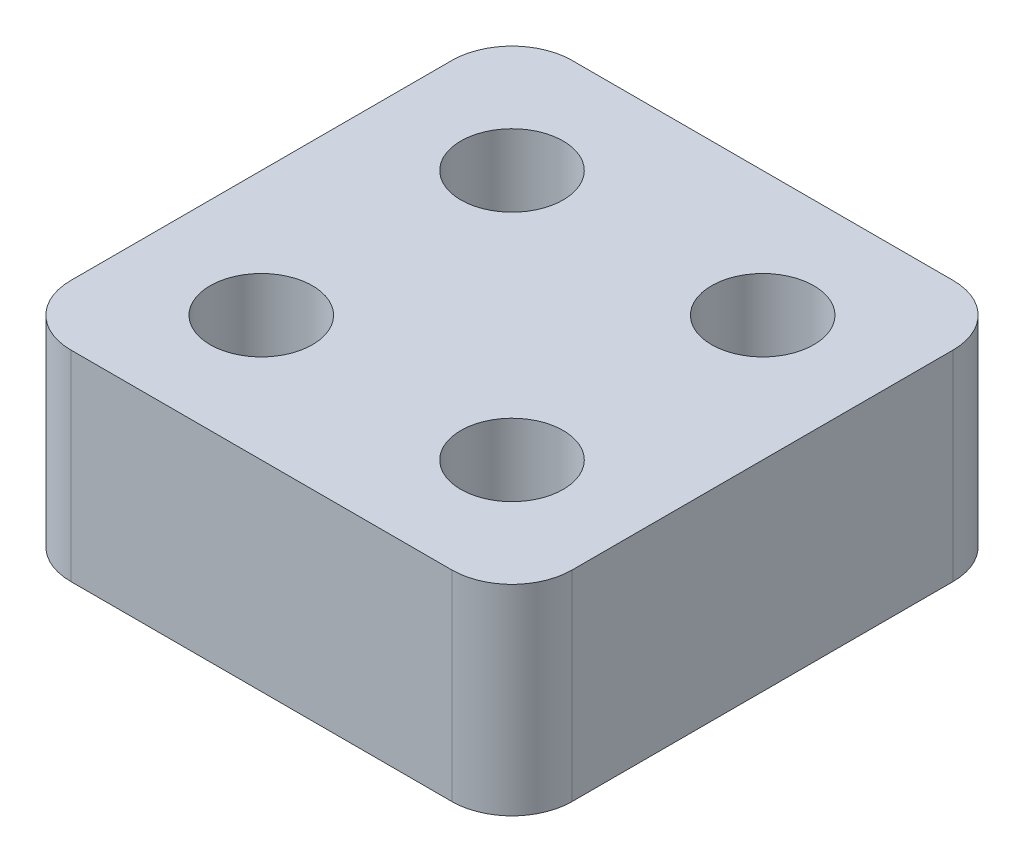
from build123d import *

# Parameters (mm, degrees)
SKETCH_1_R      = 2.55
EXTRUDE_1_DEPTH = 10


with BuildPart() as part:
    # 草图1 → 凸台-拉伸1 (new body)
    with BuildSketch(Plane(origin=(0, 0, 0), x_dir=(1, 0, 0), z_dir=(0, 1, 0))):
        with BuildLine():
            Line((-9.5, 12.5), (9.5, 12.5))
            ThreePointArc((9.5, 12.5), (11.621320344, 11.621320344), (12.5, 9.5))
            Line((12.5, 9.5), (12.5, -9.5))
            ThreePointArc((12.5, -9.5), (11.621320344, -11.621320344), (9.5, -12.5))
            Line((9.5, -12.5), (-9.5, -12.5))
            ThreePointArc((-9.5, -12.5), (-11.621320344, -11.621320344), (-12.5, -9.5))
            Line((-12.5, -9.5), (-12.5, 9.5))
            ThreePointArc((-12.5, 9.5), (-11.621320344, 11.621320344), (-9.5, 12.5))
        make_face()
        with Locations(Location((-6.25, 6.25, 0), (0, 0, 270))):
            Circle(SKETCH_1_R, mode=Mode.SUBTRACT)
        with Locations(Location((6.25, 6.25, 0), (0, 0, 270))):
            Circle(SKETCH_1_R, mode=Mode.SUBTRACT)
        with Locations(Location((-6.25, -6.25, 0), (0, 0, 270))):
            Circle(SKETCH_1_R, mode=Mode.SUBTRACT)
        with Locations(Location((6.25, -6.25, 0), (0, 0, 270))):
            Circle(SKETCH_1_R, mode=Mode.SUBTRACT)
    extrude(amount=EXTRUDE_1_DEPTH)


solid = part.part
